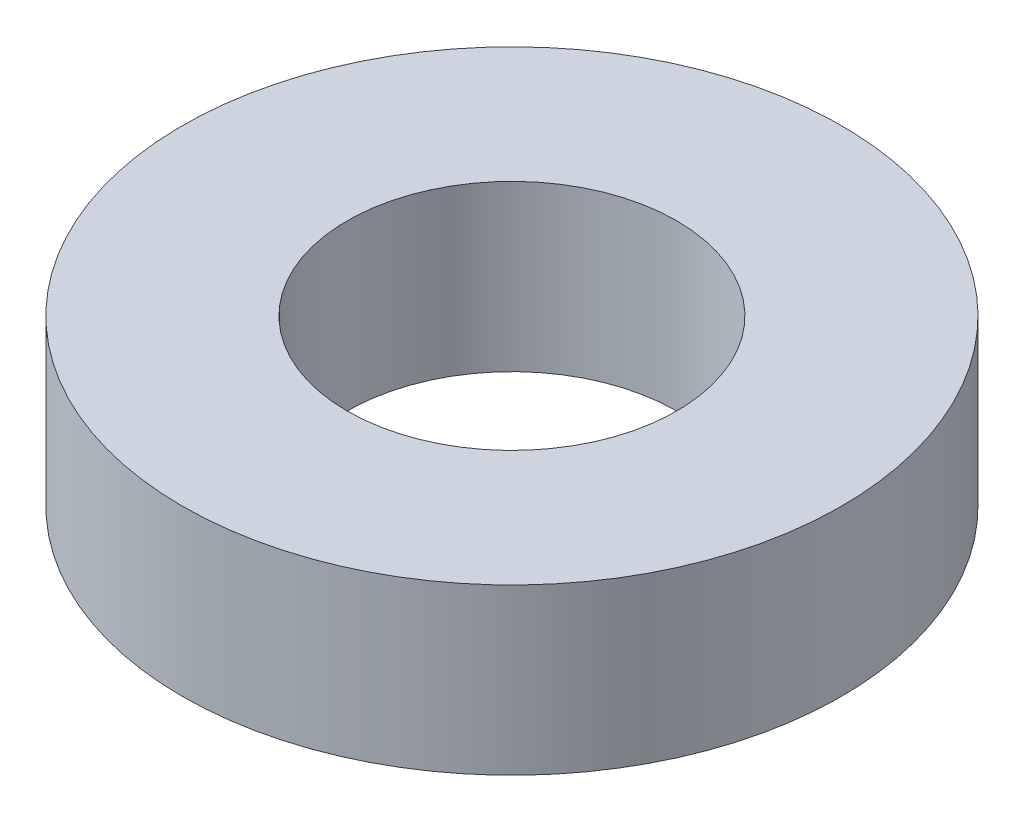
from build123d import *

# Parameters (mm, degrees)
SKETCH2_R           = 2
SKETCH2_R_2         = 1
BOSS_EXTRUDE1_DEPTH = 1


with BuildPart() as part:
    # Sketch2 → Boss-Extrude1 (new body)
    with BuildSketch(Plane(origin=(0, 0, 0), x_dir=(1, 0, 0), z_dir=(0, 1, 0))):
        with Locations(Location((0, 0, 0), (0, 0, 270))):
            Circle(SKETCH2_R)
        with Locations(Location((0, 0, 0), (0, 0, 270))):
            Circle(SKETCH2_R_2, mode=Mode.SUBTRACT)
    extrude(amount=BOSS_EXTRUDE1_DEPTH)


solid = part.part
